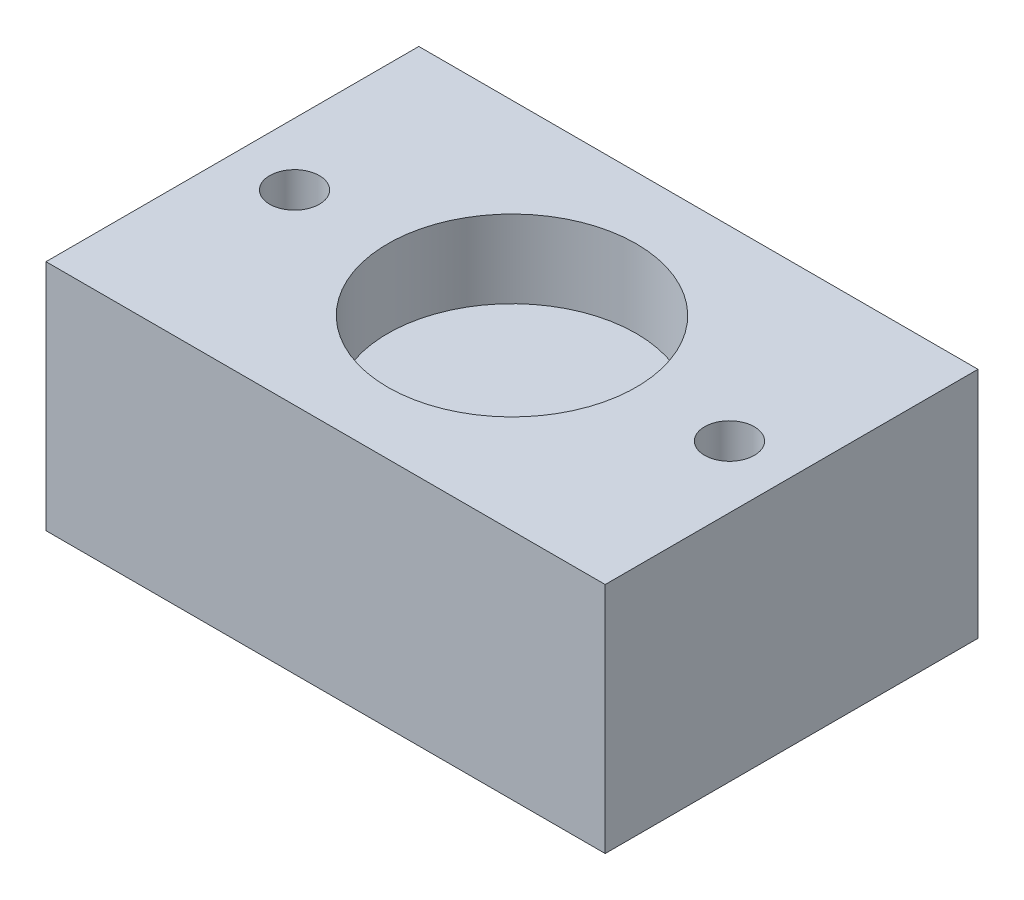
from build123d import *

# Parameters (mm, degrees)
SKETCH1_W                  = 36
SKETCH1_H                  = 24
BOSS_EXTRUDE1_DEPTH        = 15
SKETCH2_R                  = 8
CUT_EXTRUDE1_DEPTH         = 5
F_3_2_3_2_DIAMETER_HOLE1_D = 3.2


with BuildPart() as part:
    # Sketch1 → Boss-Extrude1 (new body)
    with BuildSketch(Plane(origin=(0, 0, 0), x_dir=(1, 0, 0), z_dir=(0, 1, 0))):
        with Locations((18, 12)):
            Rectangle(SKETCH1_W, SKETCH1_H)
    extrude(amount=BOSS_EXTRUDE1_DEPTH)

    # Sketch2 → Cut-Extrude1 (cut)
    with BuildSketch(Plane(origin=(0, 15, 0), x_dir=(1, 0, 0), z_dir=(0, 1, 0))):
        with Locations(Location((18, 12, 0), (0, 0, 270))):
            Circle(SKETCH2_R)
    extrude(amount=-CUT_EXTRUDE1_DEPTH, mode=Mode.SUBTRACT)

    # Ø3.2 (3.2) Diameter Hole1 (through all)
    with Locations(Plane(origin=(0, 15, 0), x_dir=(1, 0, 0), z_dir=(0, 1, 0))):
        with Locations((4, 12), (32, 12)):
            Hole(F_3_2_3_2_DIAMETER_HOLE1_D / 2)


solid = part.part
